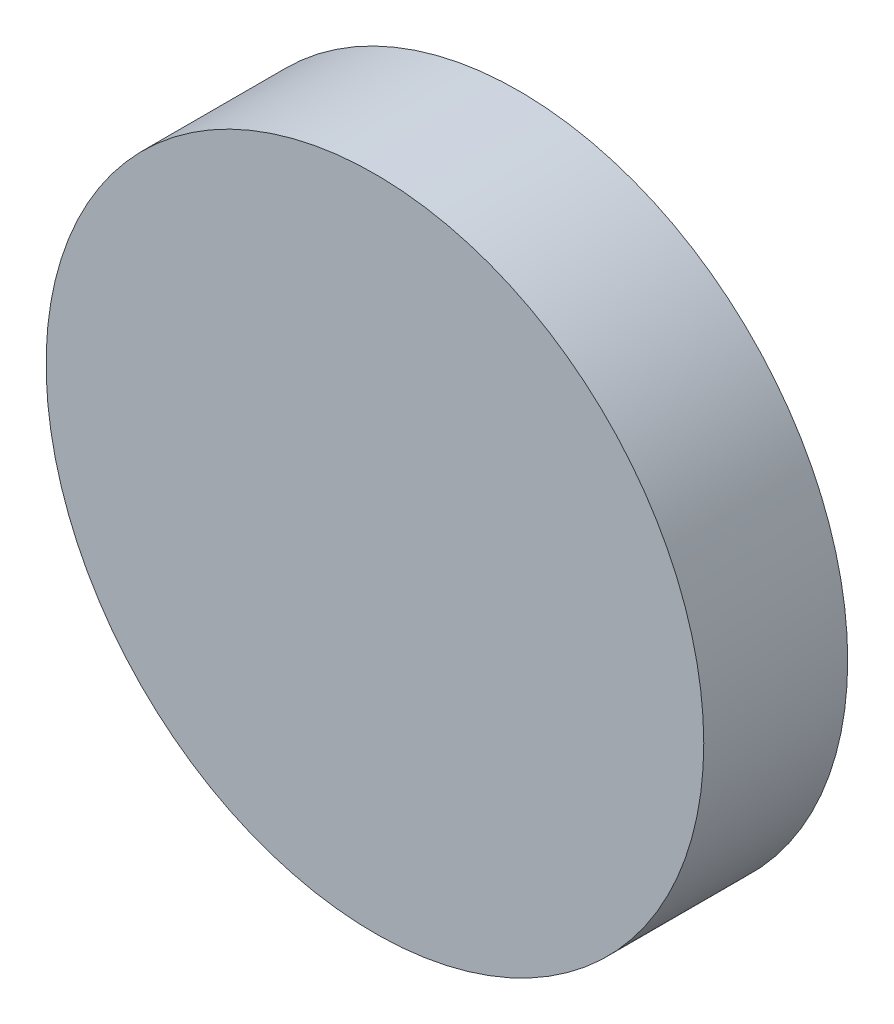
from build123d import *

# Parameters (mm, degrees)
ESBO_O1_R                = 150
RESSALTO_EXTRUS_O1_DEPTH = 100
ESBO_O3_R                = 5
CORTE_EXTRUS_O1_DEPTH    = 100
CORTE_EXTRUS_O1_DRAFT    = 69


with BuildPart() as part:
    # Esboço1 → Ressalto-extrusão1 (new body)
    with BuildSketch(Plane.XY):
        Circle(ESBO_O1_R)
    extrude(amount=RESSALTO_EXTRUS_O1_DEPTH)


with BuildPart() as corte_extrus_o1_tool:
    # Esboço3 → Corte-extrusão1 (with draft: the straight prism first)
    with BuildSketch(Plane.XY.offset(90)):
        Circle(ESBO_O3_R)
    extrude(amount=-CORTE_EXTRUS_O1_DEPTH)
    # Corte-extrusão1: the draft: its side faces are tilted about the plane it starts from
    corte_extrus_o1_sides = [corte_extrus_o1_tool.faces().sort_by_distance(p)[0] for p in [
        (-5, 0, 40),
    ]]
    draft(corte_extrus_o1_sides, Plane.XY.offset(90), CORTE_EXTRUS_O1_DRAFT)


with BuildPart() as part_1:
    add(part.part)

    # Corte-extrusão1: cut by corte_extrus_o1_tool
    add(corte_extrus_o1_tool.part, mode=Mode.SUBTRACT)


solid = part_1.part
